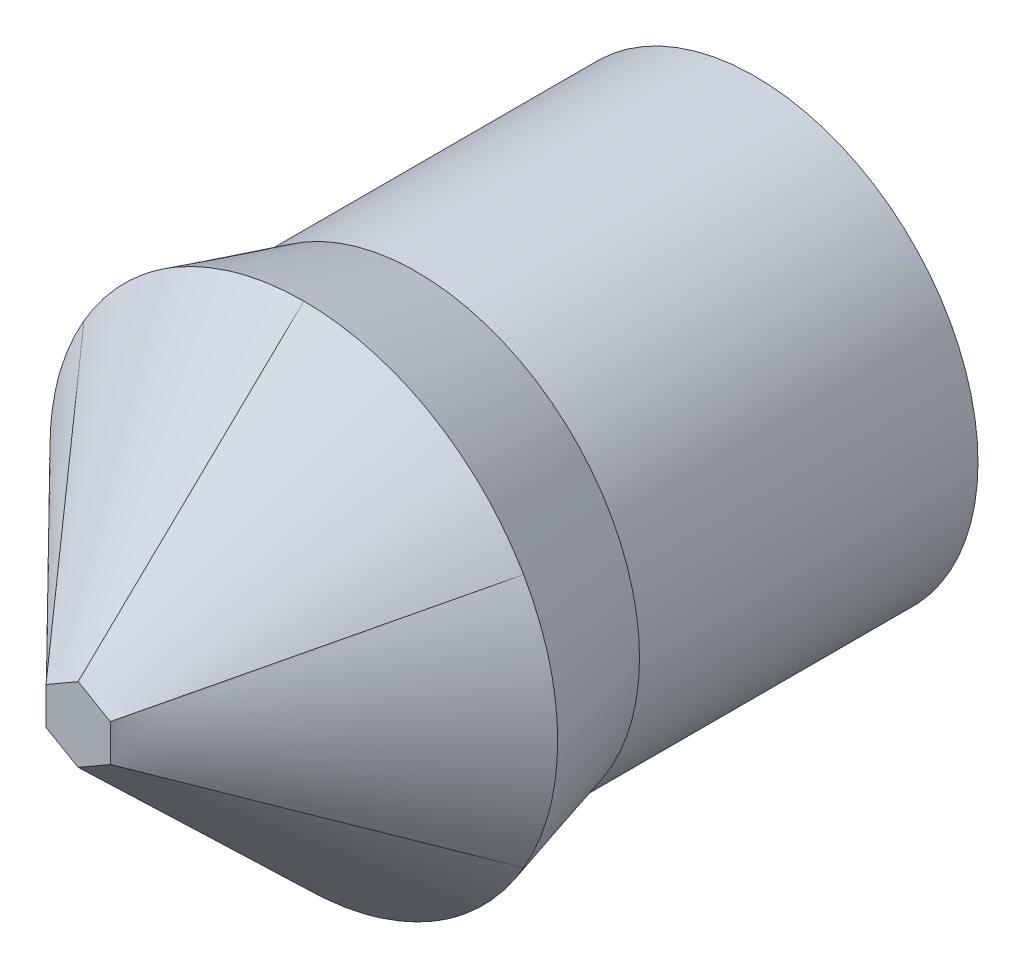
from build123d import *

# Parameters (mm, degrees)
SKETCH_1_R      = 3.95
EXTRUDE_1_DEPTH = 6
SKETCH_3_R      = 4.5
SKETCH_2_R      = 3.95


with BuildPart() as part:
    # 스케치1 → 보스-돌출1 (new body)
    with BuildSketch(Plane.XY):
        Circle(SKETCH_1_R)
    extrude(amount=EXTRUDE_1_DEPTH)

    # 스케치3 → 로프트1 section 0
    with BuildSketch(Plane.XY.offset(8)):
        Circle(SKETCH_3_R)
    # 스케치2 → 로프트1 section 1
    with BuildSketch(Plane.XY.offset(6)):
        Circle(SKETCH_2_R)
    loft()

    # 스케치5 → 로프트2 section 0
    with BuildSketch(Plane.XY.offset(12)):
        with BuildLine():
            Line((0, -0.658032332), (0.569872716, -0.329016166))
            Line((0.569872716, -0.329016166), (0.569872716, 0.329016166))
            Line((0.569872716, 0.329016166), (0, 0.658032332))
            Line((0, 0.658032332), (-0.569872716, 0.329016166))
            Line((-0.569872716, 0.329016166), (-0.569872716, -0.329016166))
            Line((-0.569872716, -0.329016166), (0, -0.658032332))
        make_face()
    # 스케치4 for 로프트2 → 로프트2 section 1
    with BuildSketch(Plane.XY.offset(8)):
        with BuildLine():
            # circular arc as an exact rational Bezier (weights 1, cos(half-angle), 1)
            Bezier((0, -4.5), (2.598076211, -4.5), (3.897114317, -2.25), weights=[1, 0.866025404, 1])
            Bezier((3.897114317, -2.25), (5.196152423, 0), (3.897114317, 2.25), weights=[1, 0.866025404, 1])
            Bezier((3.897114317, 2.25), (2.598076211, 4.5), (0, 4.5), weights=[1, 0.866025404, 1])
            Bezier((0, 4.5), (-2.598076211, 4.5), (-3.897114317, 2.25), weights=[1, 0.866025404, 1])
            Bezier((-3.897114317, 2.25), (-5.196152423, 0), (-3.897114317, -2.25), weights=[1, 0.866025404, 1])
            Bezier((-3.897114317, -2.25), (-2.598076211, -4.5), (0, -4.5), weights=[1, 0.866025404, 1])
        make_face()
    loft()


solid = part.part
